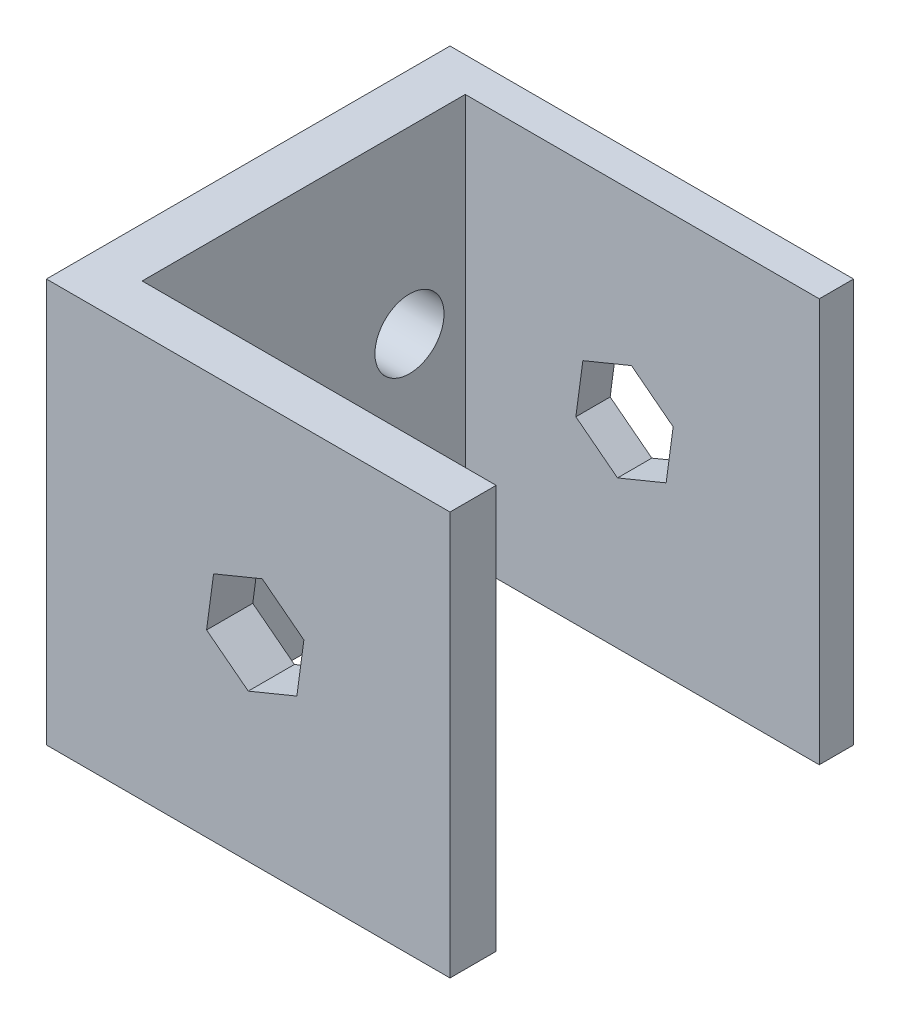
from build123d import *

# Parameters (mm, degrees)
SKETCH1_W           = 100
SKETCH1_H           = 100
BOSS_EXTRUDE1_DEPTH = 100
SKETCH2_W           = 87.717538768
SKETCH2_H           = 80.061351375
CUT_EXTRUDE1_DEPTH  = 100
CUT_EXTRUDE2_DEPTH  = 110
SKETCH4_R           = 8.561791054
CUT_EXTRUDE3_DEPTH  = 110


with BuildPart() as part:
    # Sketch1 → Boss-Extrude1 (new body)
    with BuildSketch(Plane(origin=(0, 0, 0), x_dir=(1, 0, 0), z_dir=(0, 1, 0))):
        with Locations((50, 50)):
            Rectangle(SKETCH1_W, SKETCH1_H)
    extrude(amount=BOSS_EXTRUDE1_DEPTH)

    # Sketch2 → Cut-Extrude1 (cut)
    with BuildSketch(Plane(origin=(0, 100, 0), x_dir=(1, 0, 0), z_dir=(0, 1, 0))):
        with Locations((56.141230616, 51.468802688)):
            Rectangle(SKETCH2_W, SKETCH2_H)
    extrude(amount=-CUT_EXTRUDE1_DEPTH, mode=Mode.SUBTRACT)

    # Sketch3 → Cut-Extrude2 (cut)
    with BuildSketch(Plane(origin=(0, 0, -100), x_dir=(-1, 0, 0), z_dir=(0, 0, -1))):
        Polygon((-39.686546089, 44.525018682), (-41.416801354, 57.44192417), (-53.468297277, 62.401931899), (-63.789537935, 54.44503414), (-62.05928267, 41.528128652), (-50.007786746, 36.568120923), align=None)
    extrude(amount=-CUT_EXTRUDE2_DEPTH, mode=Mode.SUBTRACT)

    # Sketch4 → Cut-Extrude3 (cut)
    with BuildSketch(Plane.ZY):
        with Locations((-77.678939526, 55.540564347)):
            Circle(SKETCH4_R)
        with Locations((-22.321060474, 55.540564347)):
            Circle(SKETCH4_R)
    extrude(amount=-CUT_EXTRUDE3_DEPTH, mode=Mode.SUBTRACT)


solid = part.part
